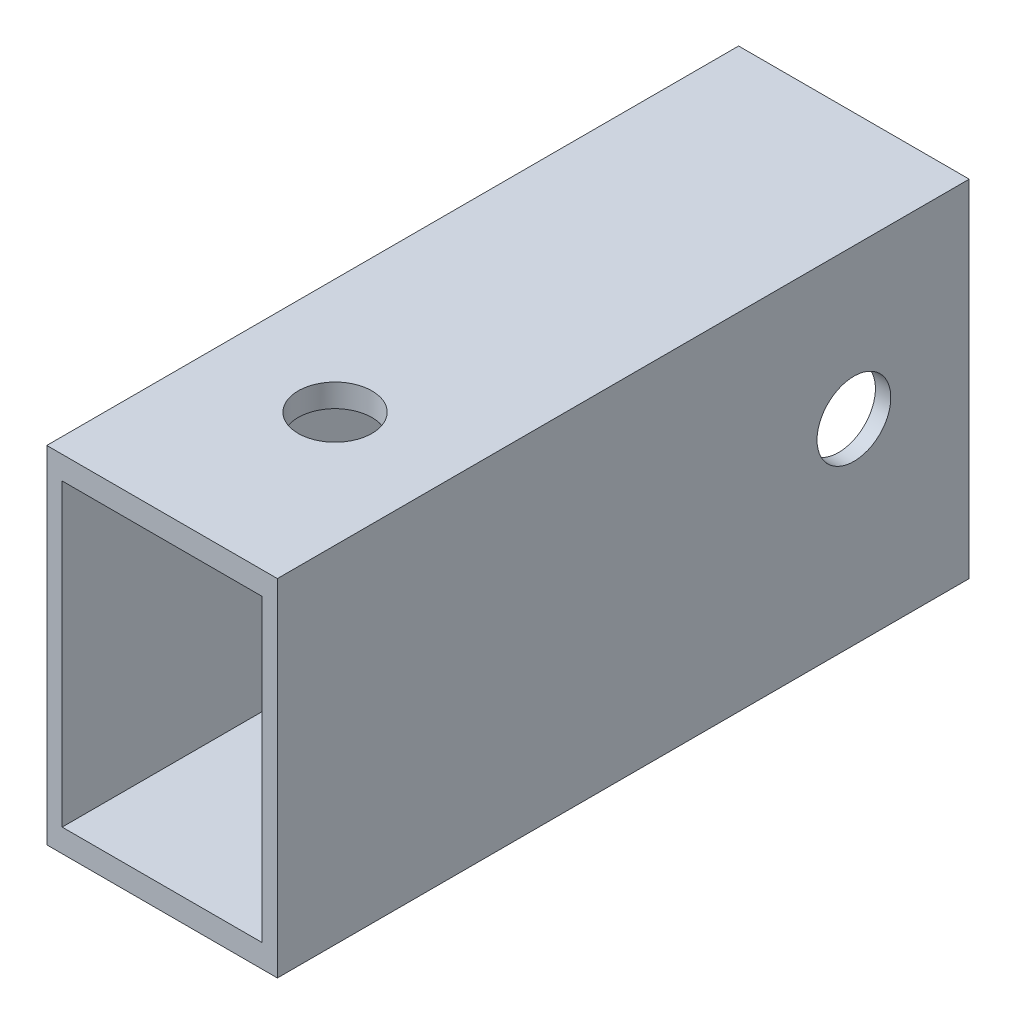
from build123d import *

# Parameters (mm, degrees)
SKETCH_1_W          = 10
SKETCH_1_H          = 15
SKETCH_1_W_2        = 8.666666666
SKETCH_1_H_2        = 13
EXTRUDE_1_DEPTH     = 30
SKETCH_3_R          = 1.6
CUT_EXTRUDE_2_DEPTH = 34.911649916
SKETCH_4_R          = 1.6
CUT_EXTRUDE_3_DEPTH = 33.5


with BuildPart() as part:
    # ｽｹｯﾁ1 → ﾎﾞｽ - 押し出し1 (new body)
    with BuildSketch(Plane.XY):
        Rectangle(SKETCH_1_W, SKETCH_1_H)
        Rectangle(SKETCH_1_W_2, SKETCH_1_H_2, mode=Mode.SUBTRACT)
    extrude(amount=EXTRUDE_1_DEPTH)

    # ｽｹｯﾁ3 → ｶｯﾄ - 押し出し2 (cut, through all)
    with BuildSketch(Plane(origin=(0, 7.5, 0), x_dir=(1, 0, 0), z_dir=(0, 1, 0))):
        with Locations(Location((0, -22.5, 0), (0, 0, 270))):
            Circle(SKETCH_3_R)
    extrude(amount=-CUT_EXTRUDE_2_DEPTH, mode=Mode.SUBTRACT)

    # ｽｹｯﾁ4 → ｶｯﾄ - 押し出し3 (cut, through all)
    with BuildSketch(Plane.ZY.offset(5)):
        with Locations((5, 1)):
            Circle(SKETCH_4_R)
    extrude(amount=-CUT_EXTRUDE_3_DEPTH, mode=Mode.SUBTRACT)


solid = part.part
